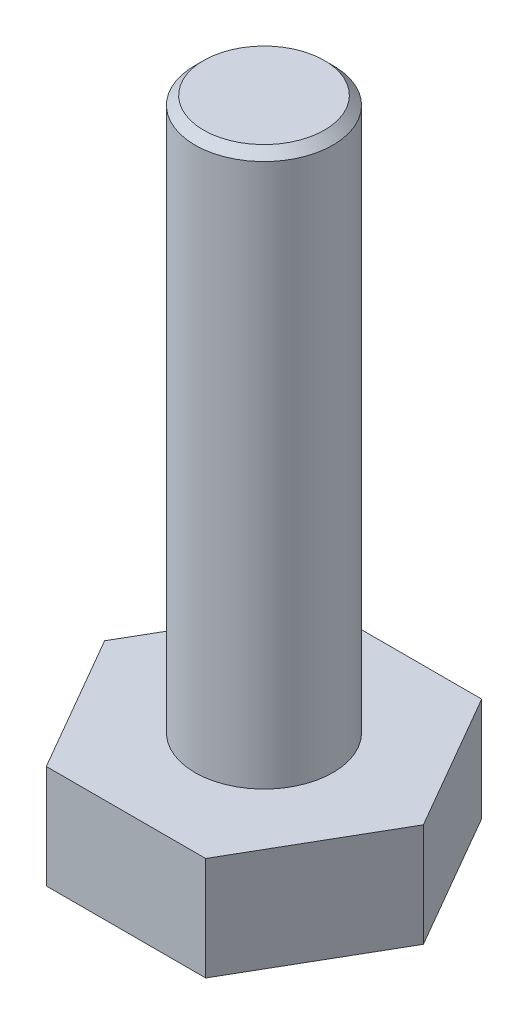
from build123d import *

# Parameters (mm, degrees)
BOSS_EXTRUDE1_DEPTH = 3
SKETCH2_R           = 2
BOSS_EXTRUDE2_DEPTH = 16
CHAMFER1_SIZE       = 0.25


with BuildPart() as part:
    # Sketch1 → Boss-Extrude1 (new body)
    with BuildSketch(Plane(origin=(0, 0, 0), x_dir=(1, 0, 0), z_dir=(0, 1, 0))):
        Polygon((4.618802154, 0), (2.309401077, 4), (-2.309401077, 4), (-4.618802154, 0), (-2.309401077, -4), (2.309401077, -4), align=None)
    extrude(amount=-BOSS_EXTRUDE1_DEPTH)

    # Sketch2 → Boss-Extrude2 (add)
    with BuildSketch(Plane(origin=(0, 0, 0), x_dir=(1, 0, 0), z_dir=(0, 1, 0))):
        with Locations(Location((0, 0, 0), (0, 0, 270))):
            Circle(SKETCH2_R)
    extrude(amount=BOSS_EXTRUDE2_DEPTH)

    # Chamfer1
    chamfer1_edges = [part.edges().sort_by_distance(p)[0] for p in [
        (0, 16, -2),
    ]]
    chamfer(chamfer1_edges, length=CHAMFER1_SIZE)


solid = part.part
